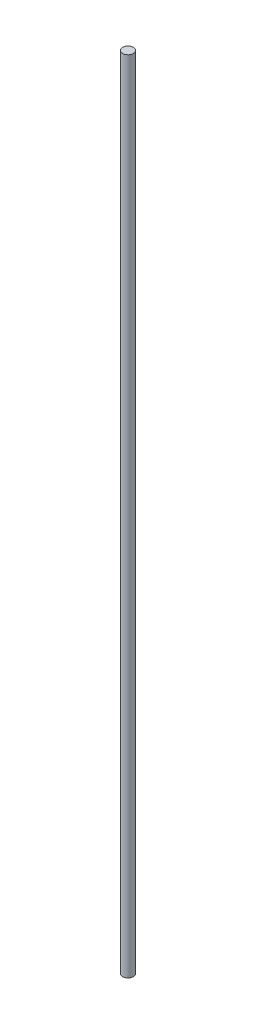
from build123d import *

# Parameters (mm, degrees)
SKETCH1_R           = 4
BOSS_EXTRUDE1_DEPTH = 595


with BuildPart() as part:
    # Sketch1 → Boss-Extrude1 (new body)
    with BuildSketch(Plane(origin=(0, 0, 0), x_dir=(1, 0, 0), z_dir=(0, 1, 0))):
        with Locations(Location((0, 0, 0), (0, 0, 270))):
            Circle(SKETCH1_R)
    extrude(amount=BOSS_EXTRUDE1_DEPTH)


solid = part.part
